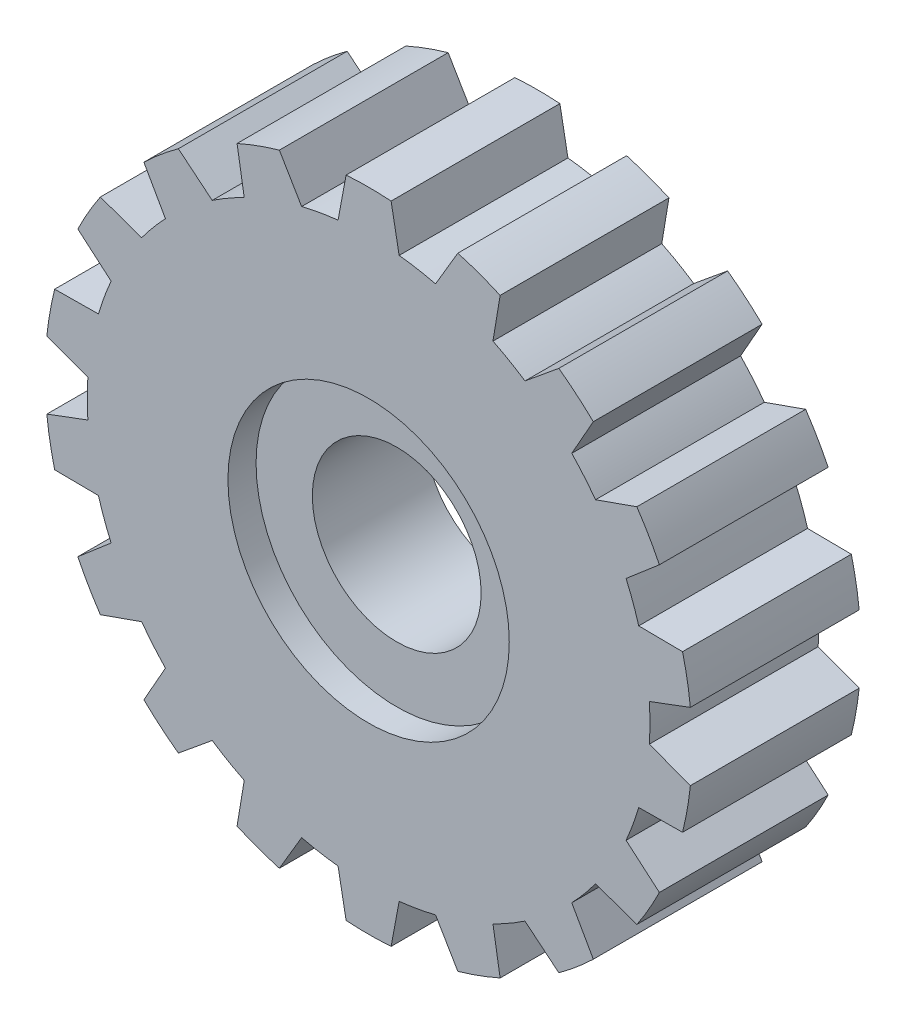
from build123d import *

# Parameters (mm, degrees)
SKIZZE1_R                       = 50
SKIZZE1_R_2                     = 15
AUFSATZ_LINEAR_AUSTRAGEN1_DEPTH = 30
AUFSATZ_LINEAR_AUSTRAGEN2_DEPTH = 30
KREISMUSTER1_COUNT              = 18
SKIZZE3_R                       = 25
SCHNITT_LINEAR_AUSTRAGEN1_DEPTH = 5
SCHNITT_LINEAR_START            = -5
SKIZZE4_R                       = 25
SCHNITT_LINEAR_AUSTRAGEN2_DEPTH = 5


with BuildPart() as part:
    # Skizze1 → Aufsatz-Linear austragen1 (new body)
    with BuildSketch(Plane.XY):
        Circle(SKIZZE1_R)
        Circle(SKIZZE1_R_2, mode=Mode.SUBTRACT)
    extrude(amount=AUFSATZ_LINEAR_AUSTRAGEN1_DEPTH)

    # Skizze2 → Aufsatz-Linear austragen2 (add)
    with BuildSketch(Plane.XY.offset(30)):
        with BuildLine():
            Line((6, 46.636185446), (-6, 46.636185446))
            Line((-6, 46.636185446), (-4, 57.360700833))
            ThreePointArc((-4, 57.360700833), (0, 57.5), (4, 57.360700833))
            Line((4, 57.360700833), (6, 46.636185446))
        make_face()
    aufsatz_linear_austragen2 = extrude(amount=-AUFSATZ_LINEAR_AUSTRAGEN2_DEPTH)

    # Kreismuster1: Aufsatz-Linear austragen2 ×18 about axis
    kreismuster1_axis = Axis((0, 0, 30), (0, 0, -1))
    for i in range(1, KREISMUSTER1_COUNT):
        add(aufsatz_linear_austragen2.rotate(kreismuster1_axis, i * 360 / KREISMUSTER1_COUNT))

    # Skizze3 → Schnitt-Linear austragen1 (cut)
    with BuildSketch(Plane.XY.offset(30)):
        Circle(SKIZZE3_R)
    extrude(amount=-SCHNITT_LINEAR_AUSTRAGEN1_DEPTH, mode=Mode.SUBTRACT)

    # Skizze4 → Schnitt-Linear austragen2 (cut)
    with BuildSketch(Plane(origin=(0, 0, 0), x_dir=(-1, 0, 0), z_dir=(0, 0, -1)).offset(SCHNITT_LINEAR_START)):
        Circle(SKIZZE4_R)
    extrude(amount=SCHNITT_LINEAR_AUSTRAGEN2_DEPTH, mode=Mode.SUBTRACT)


solid = part.part
